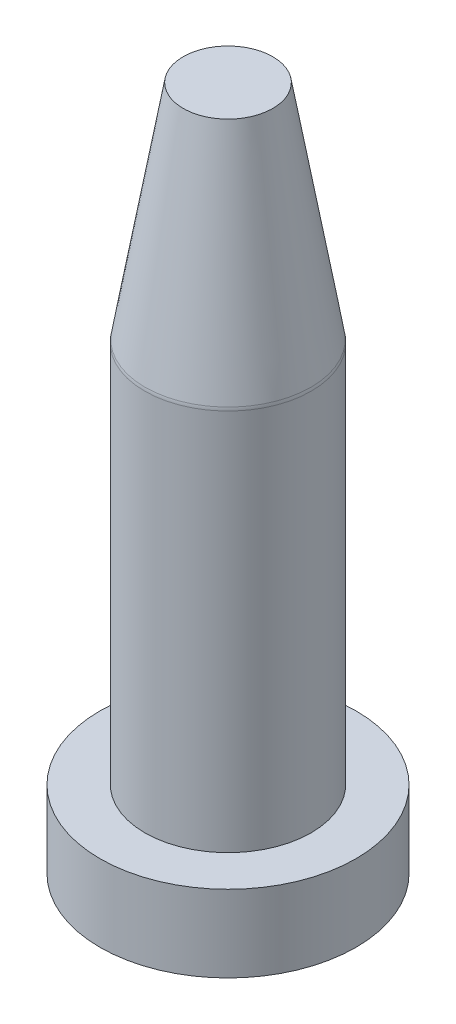
from build123d import *

# Parameters (mm, degrees)
FILLET_1_R = 3


with BuildPart() as part:
    # 草图1 → Revolve 292 (revolve)
    with BuildSketch(Plane.XY, mode=Mode.PRIVATE) as revolve_292_sk:
        Polygon((0, 0), (20, 0), (20, 12), (13, 12), (13, 72), (7, 107), (0, 107), align=None)
    revolve(revolve_292_sk.sketch.rotate(Axis((0, 0, 0), (0, 1, 0)), 90), axis=Axis((0, 0, 0), (0, 1, 0)))

    # 圆角1
    fillet_1_edges = [part.edges().sort_by_distance(p)[0] for p in [
        (0, 72, 13),
    ]]
    fillet(fillet_1_edges, radius=FILLET_1_R)


solid = part.part
